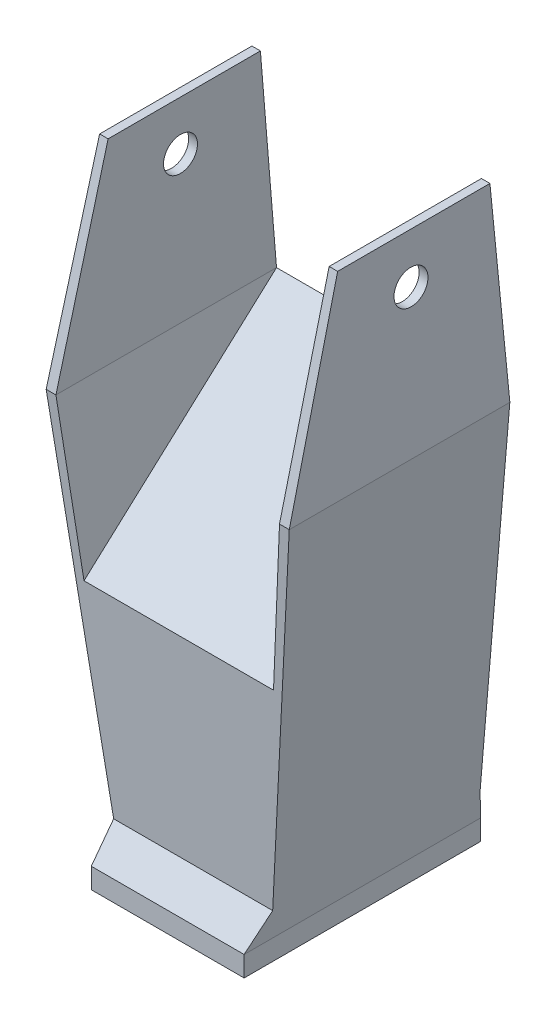
from build123d import *

# Parameters (mm, degrees)
BOSS_EXTRUDE1_DEPTH             = 71.58
CUT_EXTRUDE2_DEPTH              = 136.85530183
CUT_EXTRUDE2_DEPTH_BACK         = 136.85530183
CUT_EXTRUDE3_DEPTH              = 136.85530183
CUT_EXTRUDE3_DEPTH_BACK         = 136.85530183
CUT_EXTRUDE4_DEPTH              = 136.85530183
CUT_EXTRUDE4_DEPTH_BACK         = 136.85530183
SKETCH16_R                      = 5
CUT_EXTRUDE11_DEPTH             = 136.85530183
SKETCH17_W                      = 45
SKETCH17_H                      = 69.61
BOSS_EXTRUDE2_DEPTH             = 6
SKETCH18_R                      = 4.9
BOSS_EXTRUDE3_DEPTH             = 10
CUT_EXTRUDE12_REACH             = 151.101
CUT_EXTRUDE12_DIRECTION_2_REACH = 151.101
BOSS_EXTRUDE4_REACH             = 150.692


with BuildPart() as part:
    # Sketch2 → Boss-Extrude1 (new body)
    with BuildSketch(Plane(origin=(0, 0, 0), x_dir=(0, 0, -1), z_dir=(1, 0, 0))):
        Polygon((-35.251160643, -109.956001694), (34.358839357, -109.956001694), (33.316287702, -102.063950804), (29.698839357, 5.004872941), (24.583736048, 63.004872941), (-20.256263952, 63.004872941), (-35.251160643, 5.004872941), (-27.753712298, -102.063950804), align=None)
    extrude(amount=BOSS_EXTRUDE1_DEPTH)

    # Sketch4 → Cut-Extrude2 (cut, two sides: drawn at the far end of the back side and taken through both)
    with BuildSketch(Plane.XY.offset(-CUT_EXTRUDE2_DEPTH_BACK)):
        Polygon((58.29, -109.956001694), (71.58, 5.004872941), (71.58, -109.956001694), align=None)
        Polygon((0, 5.004872941), (13.29, -109.956001694), (0, -109.956001694), align=None)
    extrude(amount=CUT_EXTRUDE2_DEPTH + CUT_EXTRUDE2_DEPTH_BACK, mode=Mode.SUBTRACT)

    # Sketch5 → Cut-Extrude3 (cut, two sides: drawn at the far end of the back side and taken through both)
    with BuildSketch(Plane.XY.offset(-CUT_EXTRUDE3_DEPTH_BACK)):
        Polygon((0, 5.004872941), (0, 63.004872941), (0.75, 63.004872941), align=None)
        Polygon((71.58, 63.004872941), (70.83, 63.004872941), (71.58, 5.004872941), align=None)
    extrude(amount=CUT_EXTRUDE3_DEPTH + CUT_EXTRUDE3_DEPTH_BACK, mode=Mode.SUBTRACT)

    # Sketch9 → Cut-Extrude4 (cut, two sides: drawn at the far end of the back side and taken through both)
    with BuildSketch(Plane.XY.offset(-CUT_EXTRUDE4_DEPTH_BACK)):
        Polygon((3.25, 63.004872941), (68.33, 63.004872941), (68.705, 5.004872941), (2.875, 5.004872941), align=None)
    extrude(amount=CUT_EXTRUDE4_DEPTH + CUT_EXTRUDE4_DEPTH_BACK, mode=Mode.SUBTRACT)

    # Sketch16 → Cut-Extrude11 (cut, through all)
    with BuildSketch(Plane(origin=(0, 0, 0), x_dir=(0, 0, -1), z_dir=(1, 0, 0))):
        with Locations(Location((1.149194348, 48.404872941, 0), (0, 0, 90))):
            Circle(SKETCH16_R)
    extrude(amount=CUT_EXTRUDE11_DEPTH, mode=Mode.SUBTRACT)

    # Sketch17 → Boss-Extrude2 (add)
    with BuildSketch(Plane.XZ.offset(109.956001694)):
        with Locations((35.79, 0.446160643)):
            Rectangle(SKETCH17_W, SKETCH17_H)
    extrude(amount=BOSS_EXTRUDE2_DEPTH)

    # Sketch18 → Boss-Extrude3 (add)
    with BuildSketch(Plane.XZ.offset(115.956001694)):
        with Locations(Location((35.79, 0.446160643, 0), (0, 0, 270))):
            Circle(SKETCH18_R)
    extrude(amount=BOSS_EXTRUDE3_DEPTH)

    # Cut-Extrude12: up to this plane
    cut_extrude12_end = Plane(origin=(71.58, -102.063950804, -33.316287702), z_dir=(0, -0.03376692966076465, 0.999429734629346))
    # Sketch19 → Cut-Extrude12 (cut, up to the surface)
    with BuildSketch(Plane.XY, mode=Mode.PRIVATE) as cut_extrude12_sk1:
        Polygon((2.875, 5.004872941), (7.892261572, -41.495127059), (63.687738428, -41.495127059), (68.705, 5.004872941), align=None)
    cut_extrude12_tool1 = split(extrude(cut_extrude12_sk1.sketch, amount=-CUT_EXTRUDE12_REACH, mode=Mode.PRIVATE), bisect_by=cut_extrude12_end, keep=Keep.BOTH, mode=Mode.PRIVATE)
    add(cut_extrude12_tool1.solids().sort_by_distance((35.79, -17.605725, 0))[0], mode=Mode.SUBTRACT)

    # Cut-Extrude12 direction 2: up to this plane
    cut_extrude12_direction_2_end = Plane(origin=(71.58, 5.004872941, 35.251160643), z_dir=(0, 0.06985351817200207, -0.9975572595089436))
    # Sketch19 → Cut-Extrude12 direction 2 (cut, up to the surface)
    with BuildSketch(Plane.XY, mode=Mode.PRIVATE) as cut_extrude12_direction_2_sk1:
        Polygon((2.875, 5.004872941), (7.892261572, -41.495127059), (63.687738428, -41.495127059), (68.705, 5.004872941), align=None)
    cut_extrude12_direction_2_tool1 = split(extrude(cut_extrude12_direction_2_sk1.sketch, amount=CUT_EXTRUDE12_DIRECTION_2_REACH, mode=Mode.PRIVATE), bisect_by=cut_extrude12_direction_2_end, keep=Keep.BOTH, mode=Mode.PRIVATE)
    add(cut_extrude12_direction_2_tool1.solids().sort_by_distance((35.79, -17.605725, 0))[0], mode=Mode.SUBTRACT)

    # Boss-Extrude4: up to this plane
    boss_extrude4_end = Plane(origin=(63.687738428, -41.495127059, -111.104129622), z_dir=(0.9942293381213047, -0.10727545487609211, 0))
    # Sketch20 → Boss-Extrude4 (add, up to the surface)
    with BuildSketch(Plane(origin=(3.375716186, 0.364233357, 0), x_dir=(0, 0, -1), z_dir=(0.9942293381213048, 0.10727545487609252, 0)), mode=Mode.PRIVATE) as boss_extrude4_sk1:
        Polygon((29.698839357, 4.667574579), (-31.995018137, -42.102318661), (31.269897506, -42.102318661), align=None)
    boss_extrude4_tool1 = split(extrude(boss_extrude4_sk1.sketch, amount=BOSS_EXTRUDE4_REACH, dir=(1, 0, 0), mode=Mode.PRIVATE), bisect_by=boss_extrude4_end, keep=Keep.BOTH, mode=Mode.PRIVATE)
    add(boss_extrude4_tool1.solids().sort_by_distance((6.219841, -25.995127, -9.657906))[0])


solid = part.part
